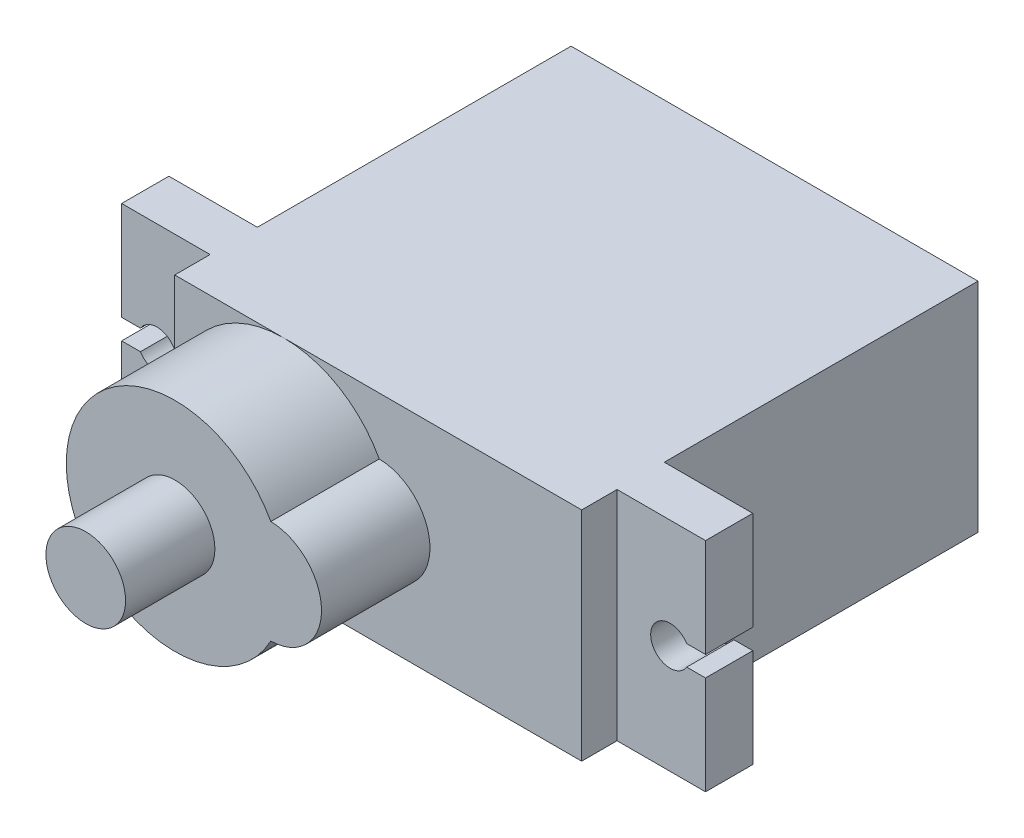
from build123d import *

# Parameters (mm, degrees)
SKETCH2_W           = 23
SKETCH2_H           = 12.3
BOSS_EXTRUDE1_DEPTH = 22.4
SKETCH3_W           = 2.67
SKETCH3_H           = 12.3
BOSS_EXTRUDE2_DEPTH = 5
CUT_EXTRUDE1_DEPTH  = 27.948701267
BOSS_EXTRUDE3_DEPTH = 6.13
SKETCH5_R           = 2.25
BOSS_EXTRUDE4_DEPTH = 5.05


with BuildPart() as part:
    # Sketch2 → Boss-Extrude1 (new body)
    with BuildSketch(Plane.XY):
        Rectangle(SKETCH2_W, SKETCH2_H)
    extrude(amount=BOSS_EXTRUDE1_DEPTH)

    # Sketch3 → Boss-Extrude2 (add)
    with BuildSketch(Plane(origin=(11.5, 0, 0), x_dir=(0, 0, -1), z_dir=(1, 0, 0))):
        with Locations((-19.065, 0)):
            Rectangle(SKETCH3_W, SKETCH3_H)
    boss_extrude2 = extrude(amount=BOSS_EXTRUDE2_DEPTH)

    # Sketch6 → Cut-Extrude1 (cut, through all)
    with BuildSketch(Plane.XY.offset(20.4)):
        with BuildLine():
            Line((15.437749967, 0.575), (16.5, 0.575))
            Line((16.5, 0.575), (16.5, -0.575))
            Line((16.5, -0.575), (15.437749967, -0.575))
            ThreePointArc((15.437749967, -0.575), (13.4, 0), (15.437749967, 0.575))
        make_face()
    cut_extrude1 = extrude(amount=-CUT_EXTRUDE1_DEPTH, mode=Mode.SUBTRACT)

    # Mirror1: Boss-Extrude2, Cut-Extrude1 across plane
    add(boss_extrude2.mirror(Plane(origin=(0, 0, 0), x_dir=(0, 0, 1), z_dir=(1, 0, 0))))
    add(cut_extrude1.mirror(Plane(origin=(0, 0, 0), x_dir=(0, 0, 1), z_dir=(1, 0, 0))), mode=Mode.SUBTRACT)

    # Sketch4 → Boss-Extrude3 (add)
    with BuildSketch(Plane.XY.offset(22.4)):
        with BuildLine():
            ThreePointArc((0.060221963, 2.924379988), (-11.5, 0), (0.060221963, -2.924379988))
            ThreePointArc((0.060221963, -2.924379988), (2.925, 0), (0.060221963, 2.924379988))
        make_face()
    extrude(amount=BOSS_EXTRUDE3_DEPTH)

    # Sketch5 → Boss-Extrude4 (add)
    with BuildSketch(Plane.XY.offset(28.53)):
        with Locations((-5.35, 0)):
            Circle(SKETCH5_R)
    extrude(amount=BOSS_EXTRUDE4_DEPTH)


solid = part.part
